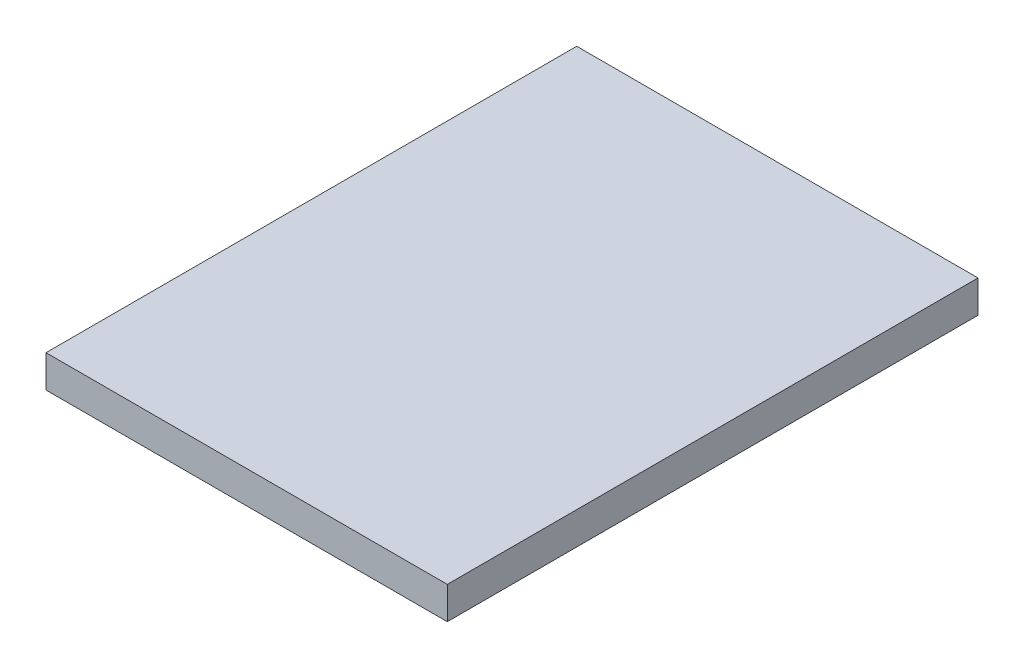
from build123d import *

# Parameters (mm, degrees)
SKETCH1_W           = 310
SKETCH1_H           = 410
BOSS_EXTRUDE1_DEPTH = 25


with BuildPart() as part:
    # Sketch1 → Boss-Extrude1 (new body)
    with BuildSketch(Plane(origin=(0, 0, 0), x_dir=(1, 0, 0), z_dir=(0, 1, 0))):
        with Locations((0, 205)):
            Rectangle(SKETCH1_W, SKETCH1_H)
    extrude(amount=-BOSS_EXTRUDE1_DEPTH)


solid = part.part
